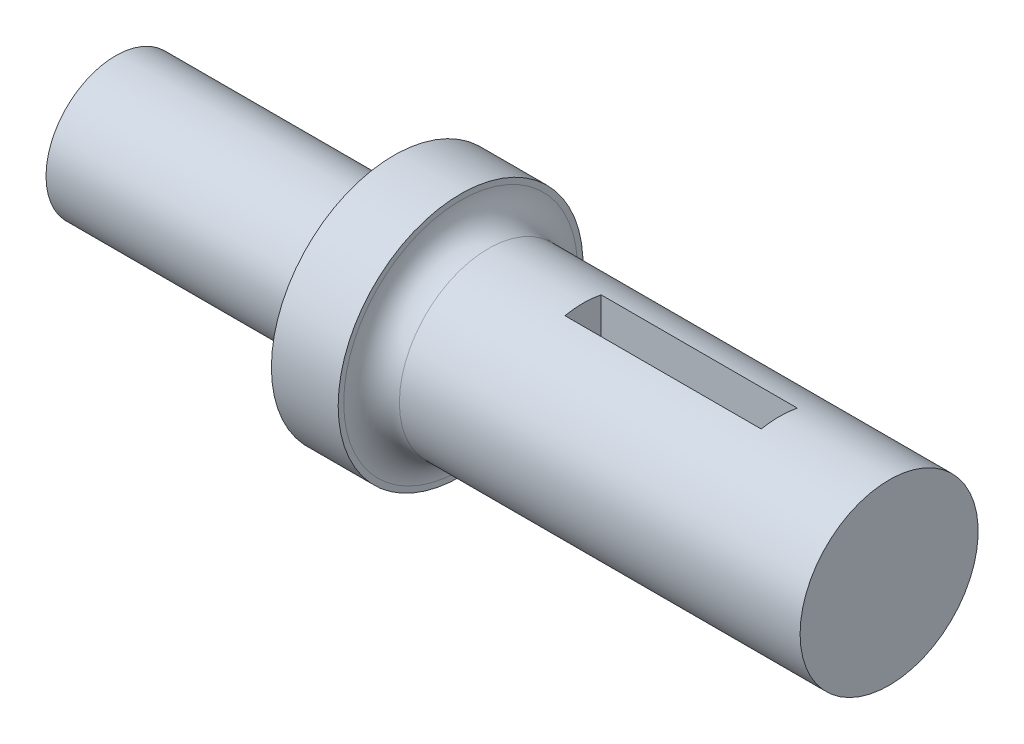
from build123d import *

# Parameters (mm, degrees)
CUT_EXTRUDE1_DEPTH = 3.25


with BuildPart() as part:
    # Sketch1 → Revolve1 (revolve)
    with BuildSketch(Plane(origin=(0, 0, 0), x_dir=(1, 0, 0), z_dir=(0, 1, 0)), mode=Mode.PRIVATE) as revolve1_sk:
        with BuildLine():
            Line((-139, 0), (0, 0))
            Line((0, 0), (0, 16))
            Line((0, 16), (-72, 16))
            ThreePointArc((-72, 16), (-75.535533906, 17.464466094), (-77, 21))
            Line((-77, 21), (-77, 22))
            Line((-77, 22), (-89, 22))
            Line((-89, 22), (-89, 12.5))
            Line((-89, 12.5), (-139, 12.5))
            Line((-139, 12.5), (-139, 0))
        make_face()
    revolve(revolve1_sk.sketch.rotate(Axis((-139, 0, 0), (1, 0, 0)), 180), axis=Axis((-139, 0, 0), (1, 0, 0)))

    # Sketch2 → Cut-Extrude1 (cut, symmetric)
    with BuildSketch(Plane.XY):
        Polygon((-55, 0), (-55, 50), (-17, 50), (-25, -50), (-55, -50), align=None)
    extrude(amount=CUT_EXTRUDE1_DEPTH, both=True, mode=Mode.SUBTRACT)


solid = part.part
